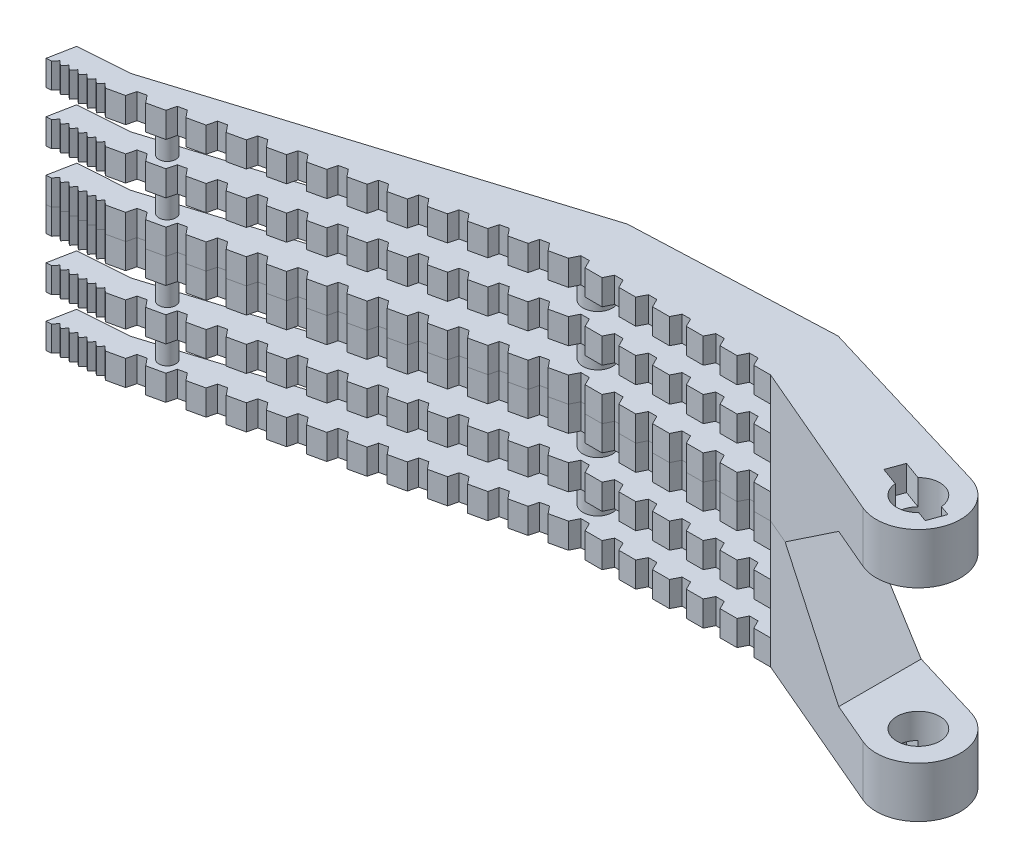
from build123d import *

# Parameters (mm, degrees)
EXTRUDE_2_DEPTH                = 15
EXTRUDE_2_DEPTH_BACK           = 15
CUT_EXTRUDE_7_DEPTH            = 99.424677187
CUT_EXTRUDE_7_DEPTH_BACK       = 99.424677187
CUT_EXTRUDE_8_DEPTH            = 99.424677187
CUT_EXTRUDE_8_DEPTH_BACK       = 99.424677187
SKETCH_3_W                     = 100
SKETCH_3_H                     = 3
EXTRUDE_START                  = -27
SKETCH_4_R                     = 1.75
SKETCH_4_R_2                   = 1
EXTRUDE_3_DEPTH                = 24
SKETCH_5_R                     = 2.55
CUT_EXTRUDE_2_DEPTH            = 102.795958069
CUT_EXTRUDE_5_DEPTH            = 3
SPLIT_BODIES_1_SURFACE_1_BACK  = 108.515
SPLIT_BODIES_1_SURFACE_1_DEPTH = 217.03
SPLIT_BODIES_1_SURFACE_2_BACK  = 108.515
SPLIT_BODIES_1_SURFACE_2_DEPTH = 217.03


with BuildPart() as part:
    # 草图1 → 凸台-拉伸2 (new, two sides: drawn at the far end of the back side and taken through both)
    with BuildSketch(Plane(origin=(0, 0, 0), x_dir=(1, 0, 0), z_dir=(0, 1, 0)).offset(-EXTRUDE_2_DEPTH_BACK)):
        with BuildLine():
            Line((-1.965078437, -4.597658832), (-21.095395232, 3.57880106))
            Line((-21.095395232, 3.57880106), (-23.095395232, 3.57880106))
            Line((-23.095395232, 3.57880106), (-23.595395232, 4.57880106))
            Line((-23.595395232, 4.57880106), (-24.595395232, 4.57880106))
            Line((-24.595395232, 4.57880106), (-25.095395232, 3.57880106))
            Line((-25.095395232, 3.57880106), (-27.095395232, 3.57880106))
            Line((-27.095395232, 3.57880106), (-27.595395232, 4.57880106))
            Line((-27.595395232, 4.57880106), (-28.595395232, 4.57880106))
            Line((-28.595395232, 4.57880106), (-29.095395232, 3.57880106))
            Line((-29.095395232, 3.57880106), (-31.095395232, 3.57880106))
            Line((-31.095395232, 3.57880106), (-31.595395232, 4.57880106))
            Line((-31.595395232, 4.57880106), (-32.595395232, 4.57880106))
            Line((-32.595395232, 4.57880106), (-33.095395232, 3.57880106))
            Line((-33.095395232, 3.57880106), (-35.095395232, 3.57880106))
            Line((-35.095395232, 3.57880106), (-35.595395232, 4.57880106))
            Line((-35.595395232, 4.57880106), (-36.595395232, 4.57880106))
            Line((-36.595395232, 4.57880106), (-37.095395232, 3.57880106))
            Line((-37.095395232, 3.57880106), (-39.095395232, 3.57880106))
            Line((-39.095395232, 3.57880106), (-39.595395232, 4.57880106))
            Line((-39.595395232, 4.57880106), (-40.595395232, 4.57880106))
            Line((-40.595395232, 4.57880106), (-41.095395232, 3.57880106))
            Line((-41.095395232, 3.57880106), (-43.095395232, 3.57880106))
            Line((-43.095395232, 3.57880106), (-43.595395232, 4.57880106))
            Line((-43.595395232, 4.57880106), (-44.595395232, 4.57880106))
            Line((-44.595395232, 4.57880106), (-45.095395232, 3.57880106))
            Line((-45.095395232, 3.57880106), (-47.047769352, 3.144940144))
            Line((-47.047769352, 3.144940144), (-47.75279334, 4.012661975))
            Line((-47.75279334, 4.012661975), (-48.7289804, 3.795731517))
            Line((-48.7289804, 3.795731517), (-49.000143472, 2.711079228))
            Line((-49.000143472, 2.711079228), (-50.952517593, 2.277218313))
            Line((-50.952517593, 2.277218313), (-51.657541581, 3.144940144))
            Line((-51.657541581, 3.144940144), (-52.633728641, 2.928009686))
            Line((-52.633728641, 2.928009686), (-52.904891713, 1.843357397))
            Line((-52.904891713, 1.843357397), (-54.857265833, 1.409496481))
            Line((-54.857265833, 1.409496481), (-55.562289821, 2.277218313))
            Line((-55.562289821, 2.277218313), (-56.538476881, 2.060287855))
            Line((-56.538476881, 2.060287855), (-56.809639954, 0.975635566))
            Line((-56.809639954, 0.975635566), (-58.762014074, 0.54177465))
            Line((-58.762014074, 0.54177465), (-59.467038062, 1.409496481))
            Line((-59.467038062, 1.409496481), (-60.443225122, 1.192566024))
            Line((-60.443225122, 1.192566024), (-60.714388194, 0.107913735))
            Line((-60.714388194, 0.107913735), (-62.666762315, -0.325947181))
            Line((-62.666762315, -0.325947181), (-63.371786303, 0.54177465))
            Line((-63.371786303, 0.54177465), (-64.347973363, 0.324844192))
            Line((-64.347973363, 0.324844192), (-64.619136435, -0.759808097))
            Line((-64.619136435, -0.759808097), (-66.571510556, -1.193669012))
            Line((-66.571510556, -1.193669012), (-67.276534543, -0.325947181))
            Line((-67.276534543, -0.325947181), (-68.252721604, -0.542877639))
            Line((-68.252721604, -0.542877639), (-68.523884676, -1.627529928))
            Line((-68.523884676, -1.627529928), (-70.476258796, -2.061390844))
            Line((-70.476258796, -2.061390844), (-71.181282784, -1.193669012))
            Line((-71.181282784, -1.193669012), (-72.157469844, -1.41059947))
            Line((-72.157469844, -1.41059947), (-72.428632917, -2.495251759))
            Line((-72.428632917, -2.495251759), (-74.381007037, -2.929112675))
            Line((-74.381007037, -2.929112675), (-75.086031025, -2.061390844))
            Line((-75.086031025, -2.061390844), (-76.062218085, -2.278321301))
            Line((-76.062218085, -2.278321301), (-76.333381157, -3.362973591))
            Line((-76.333381157, -3.362973591), (-78.285755278, -3.796834506))
            Line((-78.285755278, -3.796834506), (-78.990779266, -2.929112675))
            Line((-78.990779266, -2.929112675), (-79.966966326, -3.146043133))
            Line((-79.966966326, -3.146043133), (-80.238129398, -4.230695422))
            Line((-80.238129398, -4.230695422), (-82.190503519, -4.664556337))
            Line((-82.190503519, -4.664556337), (-82.895527506, -3.796834506))
            Line((-82.895527506, -3.796834506), (-83.871714567, -4.013764964))
            Line((-83.871714567, -4.013764964), (-84.142877639, -5.098417253))
            Line((-84.142877639, -5.098417253), (-86.095251759, -5.532278169))
            Line((-86.095251759, -5.532278169), (-86.800275747, -4.664556337))
            Line((-86.800275747, -4.664556337), (-87.776462807, -4.881486795))
            Line((-87.776462807, -4.881486795), (-88.04762588, -5.966139084))
            Line((-88.04762588, -5.966139084), (-90, -6.4))
            Line((-90, -6.4), (-90.534206574, -5.93672542))
            Line((-90.534206574, -5.93672542), (-90.997481154, -6.470931993))
            Line((-90.997481154, -6.470931993), (-91.531687727, -6.007657413))
            Line((-91.531687727, -6.007657413), (-91.994962308, -6.541863986))
            Line((-91.994962308, -6.541863986), (-92.529168881, -6.078589406))
            Line((-92.529168881, -6.078589406), (-92.992443462, -6.612795979))
            Line((-92.992443462, -6.612795979), (-93.526650035, -6.149521399))
            Line((-93.526650035, -6.149521399), (-93.989924616, -6.683727973))
            Line((-93.989924616, -6.683727973), (-94.524131189, -6.220453392))
            Line((-94.524131189, -6.220453392), (-94.987405769, -6.754659966))
            Line((-94.987405769, -6.754659966), (-95.521612343, -6.291385385))
            Line((-95.521612343, -6.291385385), (-95.984886923, -6.825591959))
            Line((-95.984886923, -6.825591959), (-96.583375616, -6.868151155))
            Line((-96.583375616, -6.868151155), (-95.994348786, -3.818689182))
            Line((-95.994348786, -3.818689182), (-90, -3.39242438))
            Line((-90, -3.39242438), (-45.095395232, 10.57880106))
            Line((-45.095395232, 10.57880106), (-21.095395232, 11.57880106))
            Line((-21.095395232, 11.57880106), (1.442591054, 4.78737204))
            ThreePointArc((1.442591054, 4.78737204), (4.699781844, -1.706473152), (-1.965078437, -4.597658832))
        make_face()
    extrude(amount=EXTRUDE_2_DEPTH + EXTRUDE_2_DEPTH_BACK)

    # 草图10 → 切除-拉伸7 (cut, two sides: drawn at the far end of the back side and taken through both)
    with BuildSketch(Plane.XY.offset(-CUT_EXTRUDE_7_DEPTH_BACK)):
        Polygon((5, 9), (-7, 9), (-18.095395232, 0), (-7, -9), (5, -9), align=None)
    extrude(amount=CUT_EXTRUDE_7_DEPTH + CUT_EXTRUDE_7_DEPTH_BACK, mode=Mode.SUBTRACT)

    # 草图3 → 切除-拉伸8 (cut, two sides: drawn at the far end of the back side and taken through both)
    with BuildSketch(Plane.XY.offset(-CUT_EXTRUDE_8_DEPTH_BACK)):
        with Locations((-71.095395232, 10.5)):
            Rectangle(SKETCH_3_W, SKETCH_3_H)
        with Locations((-71.095395232, 4.5)):
            Rectangle(SKETCH_3_W, SKETCH_3_H)
        with Locations((-71.095395232, -4.5)):
            Rectangle(SKETCH_3_W, SKETCH_3_H)
        with Locations((-71.095395232, -10.5)):
            Rectangle(SKETCH_3_W, SKETCH_3_H)
    extrude(amount=CUT_EXTRUDE_8_DEPTH + CUT_EXTRUDE_8_DEPTH_BACK, mode=Mode.SUBTRACT)

    # 草图4 → 凸台-拉伸3 (add)
    with BuildSketch(Plane.XZ.offset(15).offset(EXTRUDE_START)):
        with Locations(Location((-45.095395232, -7.07880106, 0), (0, 0, 270))):
            Circle(SKETCH_4_R)
        with Locations(Location((-85.5, 3.563258985, 0), (0, 0, 270))):
            Circle(SKETCH_4_R_2)
    extrude(amount=EXTRUDE_3_DEPTH)

    # 草图5 → 切除-拉伸2 (cut, through all)
    with BuildSketch(Plane.XZ.offset(15)):
        with Locations(Location((0, 0, 0), (0, 0, 270))):
            Circle(SKETCH_5_R)
    extrude(amount=-CUT_EXTRUDE_2_DEPTH, mode=Mode.SUBTRACT)

    # 草图8 → 切除-拉伸5 (cut)
    with BuildSketch(Plane.XZ.offset(15)):
        Polygon((-4.682158658, -0.583001112), (-3.965439935, -2.556909487), (3.74220229, 0.241706482), (3.025483566, 2.215614856), align=None)
    cut_extrude_5 = extrude(amount=-CUT_EXTRUDE_5_DEPTH, mode=Mode.SUBTRACT)

    # 镜向1: 切除-拉伸5 across plane
    add(cut_extrude_5.mirror(Plane.ZX), mode=Mode.SUBTRACT)


with BuildPart() as body_2:
    # Split Bodies 1: the piece behind the surface
    add(part.part)
    # Split Bodies 1 surface: a surface, the sketch's curves swept straight by 217.03 mm
    with BuildLine(Plane.XY.offset(-SPLIT_BODIES_1_SURFACE_1_BACK), mode=Mode.PRIVATE) as split_bodies_1_surface_1_path:
        Line((-97.313256612, 0), (15.621875769, 0))
    split_bodies_1_surface_1 = Shell.extrude(split_bodies_1_surface_1_path.wire(), (0 * SPLIT_BODIES_1_SURFACE_1_DEPTH, 0 * SPLIT_BODIES_1_SURFACE_1_DEPTH, 1 * SPLIT_BODIES_1_SURFACE_1_DEPTH))
    split(bisect_by=split_bodies_1_surface_1, keep=Keep.BOTTOM)


with BuildPart() as part_1:
    add(part.part)

    # Split Bodies 1: split by a surface, the side it looks to stays
    # Split Bodies 1 surface: a surface, the sketch's curves swept straight by 217.03 mm
    with BuildLine(Plane.XY.offset(-SPLIT_BODIES_1_SURFACE_2_BACK), mode=Mode.PRIVATE) as split_bodies_1_surface_2_path:
        Line((-97.313256612, 0), (15.621875769, 0))
    split_bodies_1_surface_2 = Shell.extrude(split_bodies_1_surface_2_path.wire(), (0 * SPLIT_BODIES_1_SURFACE_2_DEPTH, 0 * SPLIT_BODIES_1_SURFACE_2_DEPTH, 1 * SPLIT_BODIES_1_SURFACE_2_DEPTH))
    split(bisect_by=split_bodies_1_surface_2, keep=Keep.TOP)


solid = Compound([body_2.part, part_1.part])
